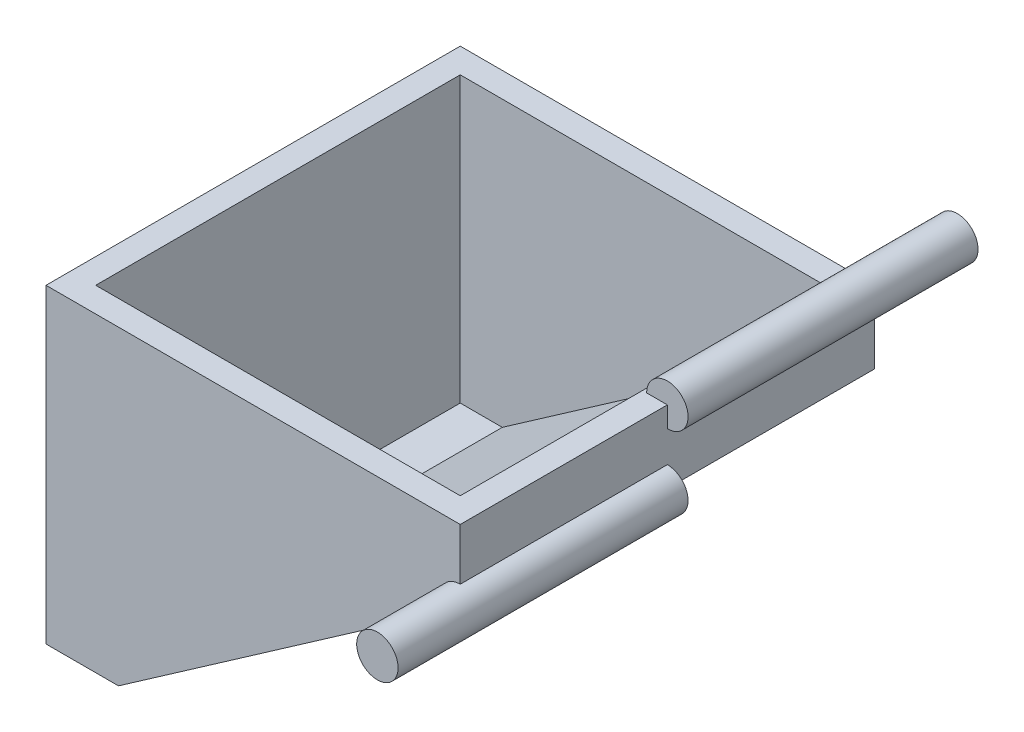
from build123d import *

# Parameters (mm, degrees)
BOSS_EXTRUDE1_DEPTH      = 2000
CUT_EXTRUDE1_DEPTH       = 1880
BOSS_EXTRUDE2_DEPTH      = 120
BOSS_EXTRUDE3_DEPTH      = 400
BOSS_EXTRUDE3_DEPTH_BACK = 1000
SKETCH6_R                = 100
BOSS_EXTRUDE4_DEPTH      = 400
BOSS_EXTRUDE4_DEPTH_BACK = 1000
SKETCH7_R                = 100


with BuildPart() as part:
    # Sketch3 → Boss-Extrude1 (new body)
    with BuildSketch(Plane.XY):
        Polygon((0, 0), (2000, 0), (2000, -350), (350, -1500), (0, -1500), align=None)
    extrude(amount=BOSS_EXTRUDE1_DEPTH)

    # Sketch4 → Cut-Extrude1 (cut)
    with BuildSketch(Plane.XY.offset(2000)):
        Polygon((120, 0), (120, -1372.482987962), (323.092909156, -1372.482987962), (1880, -287.365924646), (1880, -109.214006034), (1880, 0), align=None)
    extrude(amount=-CUT_EXTRUDE1_DEPTH, mode=Mode.SUBTRACT)

    # Sketch5 → Boss-Extrude2 (add)
    with BuildSketch(Plane.XY.offset(2000)):
        Polygon((120, 0), (120, -1372.482987962), (323.092909156, -1372.482987962), (1880, -287.365924646), (1880, 0), align=None)
    extrude(amount=-BOSS_EXTRUDE2_DEPTH)

    # Sketch6 → Boss-Extrude3 (add, two sides: drawn at the far end of the back side and taken through both)
    with BuildSketch(Plane(origin=(0, 0, 0), x_dir=(-1, 0, 0), z_dir=(0, 0, -1)).offset(-BOSS_EXTRUDE3_DEPTH_BACK)):
        with Locations((-2000, 0)):
            Circle(SKETCH6_R)
    extrude(amount=BOSS_EXTRUDE3_DEPTH + BOSS_EXTRUDE3_DEPTH_BACK)

    # Sketch7 → Boss-Extrude4 (add, two sides: drawn at the far end of the back side and taken through both)
    with BuildSketch(Plane.XY.offset(2000).offset(-BOSS_EXTRUDE4_DEPTH_BACK)):
        with Locations((2000, -350)):
            Circle(SKETCH7_R)
    extrude(amount=BOSS_EXTRUDE4_DEPTH + BOSS_EXTRUDE4_DEPTH_BACK)


solid = part.part
